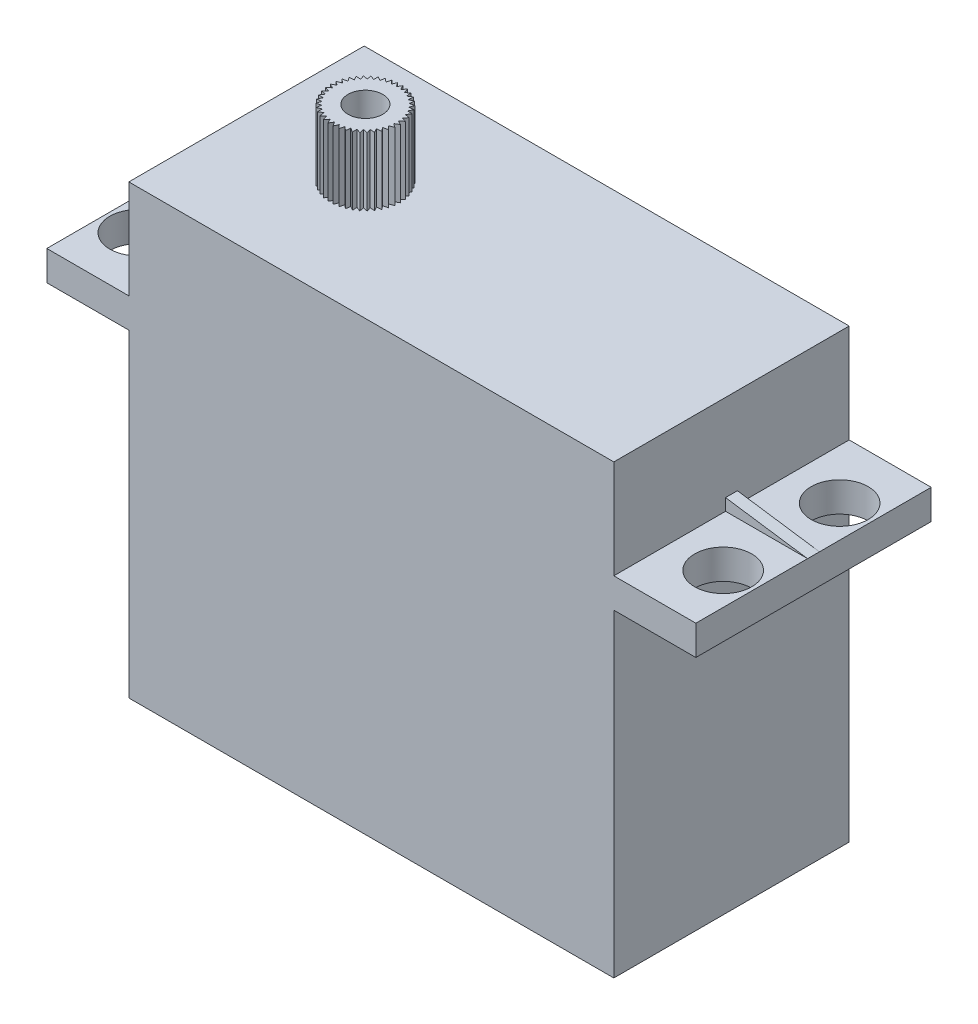
from build123d import *

# Parameters (mm, degrees)
SKETCH1_W               = 54.6
SKETCH1_H               = 19.8
FULL_BLOCK_DEPTH        = 37.6
TAB_CUT_REACH           = 52.508
SKETCH2_W               = 6.9
SKETCH2_H               = 26.8
SKETCH2_H_2             = 8.3
TAB_HOLES_1SIDE_REACH   = 43.253
SKETCH5_R               = 2.4
SKETCH6_W               = 6.9
SKETCH6_H               = 1
TAB_FIN_CHUNK_DEPTH     = 1
TAB_FIN_ANGLE_CUT_REACH = 49.615
SKETCH8_R               = 1.46
ROTOR_DEPTH             = 5.7


with BuildPart() as part:
    # Sketch1 → Full Block (new body)
    with BuildSketch(Plane(origin=(0, 0, 0), x_dir=(1, 0, 0), z_dir=(0, 1, 0))):
        Rectangle(SKETCH1_W, SKETCH1_H)
    extrude(amount=FULL_BLOCK_DEPTH)

    # Sketch2 → Tab cut (cut, up to next)
    with BuildSketch(Plane.XY.offset(9.9), mode=Mode.PRIVATE) as tab_cut_sk1:
        with Locations((-23.85, 13.4)):
            Rectangle(SKETCH2_W, SKETCH2_H)
    tab_cut_tool1 = extrude(tab_cut_sk1.sketch, amount=-TAB_CUT_REACH, mode=Mode.PRIVATE) & part.part
    # Sketch2 → Tab cut (cut, up to next)
    with BuildSketch(Plane.XY.offset(9.9), mode=Mode.PRIVATE) as tab_cut_sk2:
        with Locations((23.85, 13.4)):
            Rectangle(SKETCH2_W, SKETCH2_H)
    tab_cut_tool2 = extrude(tab_cut_sk2.sketch, amount=-TAB_CUT_REACH, mode=Mode.PRIVATE) & part.part
    # Sketch2 → Tab cut (cut, up to next)
    with BuildSketch(Plane.XY.offset(9.9), mode=Mode.PRIVATE) as tab_cut_sk3:
        with Locations((-23.85, 33.45)):
            Rectangle(SKETCH2_W, SKETCH2_H_2)
    tab_cut_tool3 = extrude(tab_cut_sk3.sketch, amount=-TAB_CUT_REACH, mode=Mode.PRIVATE) & part.part
    # Sketch2 → Tab cut (cut, up to next)
    with BuildSketch(Plane.XY.offset(9.9), mode=Mode.PRIVATE) as tab_cut_sk4:
        with Locations((23.85, 33.45)):
            Rectangle(SKETCH2_W, SKETCH2_H_2)
    tab_cut_tool4 = extrude(tab_cut_sk4.sketch, amount=-TAB_CUT_REACH, mode=Mode.PRIVATE) & part.part
    add(tab_cut_tool1.solids().sort_by_distance((-23.85, 13.4, 9.9))[0], mode=Mode.SUBTRACT)
    add(tab_cut_tool2.solids().sort_by_distance((23.85, 13.4, 9.9))[0], mode=Mode.SUBTRACT)
    add(tab_cut_tool3.solids().sort_by_distance((-23.85, 33.45, 9.9))[0], mode=Mode.SUBTRACT)
    add(tab_cut_tool4.solids().sort_by_distance((23.85, 33.45, 9.9))[0], mode=Mode.SUBTRACT)

    # Sketch5 → Tab holes (1side) (cut, up to next)
    with BuildSketch(Plane(origin=(0, 29.3, 0), x_dir=(1, 0, 0), z_dir=(0, 1, 0)), mode=Mode.PRIVATE) as tab_holes_1side_sk1:
        with Locations(Location((-24.6, 4.9, 0), (0, 0, 180))):
            Circle(SKETCH5_R)
    tab_holes_1side_tool1 = extrude(tab_holes_1side_sk1.sketch, amount=-TAB_HOLES_1SIDE_REACH, mode=Mode.PRIVATE) & part.part
    # Sketch5 → Tab holes (1side) (cut, up to next)
    with BuildSketch(Plane(origin=(0, 29.3, 0), x_dir=(1, 0, 0), z_dir=(0, 1, 0)), mode=Mode.PRIVATE) as tab_holes_1side_sk2:
        with Locations(Location((-24.6, -4.9, 0), (0, 0, 270))):
            Circle(SKETCH5_R)
    tab_holes_1side_tool2 = extrude(tab_holes_1side_sk2.sketch, amount=-TAB_HOLES_1SIDE_REACH, mode=Mode.PRIVATE) & part.part
    tab_holes_1side_1 = tab_holes_1side_tool1.solids().sort_by_distance((-24.6, 29.3, -4.9))[0]
    add(tab_holes_1side_1, mode=Mode.SUBTRACT)
    tab_holes_1side_2 = tab_holes_1side_tool2.solids().sort_by_distance((-24.6, 29.3, 4.9))[0]
    add(tab_holes_1side_2, mode=Mode.SUBTRACT)
    tab_holes_1side = tab_holes_1side_1 + tab_holes_1side_2  # Tab holes (1side) as one shape, for the pattern or mirror that repeats it

    # Tab holes mirror: Tab holes (1side) across plane
    add(tab_holes_1side.mirror(Plane(origin=(0, 0, 0), x_dir=(0, 0, 1), z_dir=(1, 0, 0))), mode=Mode.SUBTRACT)

    # Sketch6 → Tab Fin Chunk (add)
    with BuildSketch(Plane(origin=(0, 29.3, 0), x_dir=(1, 0, 0), z_dir=(0, 1, 0))):
        with Locations((-23.85, 0)):
            Rectangle(SKETCH6_W, SKETCH6_H)
    tab_fin_chunk = extrude(amount=TAB_FIN_CHUNK_DEPTH)

    # Sketch7 → Tab Fin Angle Cut (cut, up to next)
    with BuildSketch(Plane.XY.offset(0.5), mode=Mode.PRIVATE) as tab_fin_angle_cut_sk1:
        Polygon((-27.3, 29.3), (-20.4, 30.3), (-27.3, 30.3), align=None)
    tab_fin_angle_cut_tool1 = extrude(tab_fin_angle_cut_sk1.sketch, amount=-TAB_FIN_ANGLE_CUT_REACH, mode=Mode.PRIVATE) & part.part
    tab_fin_angle_cut = tab_fin_angle_cut_tool1.solids().sort_by_distance((-25, 29.966667, 0.5))[0]
    add(tab_fin_angle_cut, mode=Mode.SUBTRACT)

    # Tab Fin Mirror: Tab Fin Chunk, Tab Fin Angle Cut across plane
    add(tab_fin_chunk.mirror(Plane(origin=(0, 0, 0), x_dir=(0, 0, 1), z_dir=(1, 0, 0))))
    add(tab_fin_angle_cut.mirror(Plane(origin=(0, 0, 0), x_dir=(0, 0, 1), z_dir=(1, 0, 0))), mode=Mode.SUBTRACT)

    # Sketch8 → Rotor (add)
    with BuildSketch(Plane(origin=(0, 37.6, 0), x_dir=(1, 0, 0), z_dir=(0, 1, 0))):
        with BuildLine():
            ThreePointArc((-12.991754365, 0.206904111), (-12.991814191, 0.206153337), (-12.9918738, 0.205402545))
            Line((-12.9918738, 0.205402545), (-13.35, 0))
            Line((-13.35, 0), (-12.993644068, -0.181687781))
            ThreePointArc((-12.993644068, -0.181687781), (-12.993591329, -0.182439086), (-12.993538372, -0.183190376))
            Line((-12.993538372, -0.183190376), (-13.317050937, -0.439674685))
            Line((-13.317050937, -0.439674685), (-12.937596048, -0.566221068))
            ThreePointArc((-12.937596048, -0.566221068), (-12.937431922, -0.566956121), (-12.937267582, -0.567691128))
            Line((-12.937267582, -0.567691128), (-13.218939777, -0.869527765))
            Line((-13.218939777, -0.869527765), (-12.824862326, -0.938105912))
            ThreePointArc((-12.824862326, -0.938105912), (-12.824590478, -0.938808294), (-12.824318428, -0.939510597))
            Line((-12.824318428, -0.939510597), (-13.05785816, -1.27995703))
            Line((-13.05785816, -1.27995703), (-12.657961186, -1.28903502))
            ThreePointArc((-12.657961186, -1.28903502), (-12.65758769, -1.28968904), (-12.657214005, -1.290342952))
            Line((-12.657214005, -1.290342952), (-12.837404384, -1.661794171))
            Line((-12.837404384, -1.661794171), (-12.440620925, -1.611169216))
            ThreePointArc((-12.440620925, -1.611169216), (-12.440154124, -1.611760265), (-12.439687152, -1.612351178))
            Line((-12.439687152, -1.612351178), (-12.562503022, -2.006509576))
            Line((-12.562503022, -2.006509576), (-12.177696564, -1.897312554))
            ThreePointArc((-12.177696564, -1.897312554), (-12.177146886, -1.897827428), (-12.176597058, -1.898342143))
            Line((-12.176597058, -1.898342143), (-12.239294915, -2.306402873))
            Line((-12.239294915, -2.306402873), (-11.875061399, -2.141073065))
            ThreePointArc((-11.875061399, -2.141073065), (-11.874441122, -2.141500263), (-11.873820722, -2.141927282))
            Line((-11.873820722, -2.141927282), (-11.875, -2.554774941))
            Line((-11.875, -2.554774941), (-11.5394758, -2.337005541))
            ThreePointArc((-11.5394758, -2.337005541), (-11.538798781, -2.337335521), (-11.538121666, -2.337665304))
            Line((-11.538121666, -2.337665304), (-11.477756022, -2.746077559))
            Line((-11.477756022, -2.746077559), (-11.178436195, -2.480733176))
            ThreePointArc((-11.178436195, -2.480733176), (-11.177717557, -2.480958565), (-11.176998853, -2.481183746))
            Line((-11.176998853, -2.481183746), (-11.056436755, -2.876037341))
            Line((-11.056436755, -2.876037341), (-10.800007612, -2.569045331))
            ThreePointArc((-10.800007612, -2.569045331), (-10.799263407, -2.569161095), (-10.79851917, -2.569276644))
            Line((-10.79851917, -2.569276644), (-10.620453776, -2.941751202))
            Line((-10.620453776, -2.941751202), (-10.412643519, -2.599969258))
            ThreePointArc((-10.412643519, -2.599969258), (-10.411890373, -2.599972811), (-10.411137226, -2.599976146))
            Line((-10.411137226, -2.599976146), (-10.179546224, -2.941751202))
            Line((-10.179546224, -2.941751202), (-10.024996991, -2.572814168))
            ThreePointArc((-10.024996991, -2.572814168), (-10.024251728, -2.572705431), (-10.023506496, -2.572596479))
            Line((-10.023506496, -2.572596479), (-9.743563245, -2.876037341))
            Line((-9.743563245, -2.876037341), (-9.645727411, -2.488186661))
            ThreePointArc((-9.645727411, -2.488186661), (-9.645006678, -2.487968063), (-9.644286008, -2.487749256))
            Line((-9.644286008, -2.487749256), (-9.322243978, -2.746077559))
            Line((-9.322243978, -2.746077559), (-9.283307034, -2.347977176))
            ThreePointArc((-9.283307034, -2.347977176), (-9.282626931, -2.3476536), (-9.281946922, -2.347329827))
            Line((-9.281946922, -2.347329827), (-8.925, -2.554774941))
            Line((-8.925, -2.554774941), (-8.945831733, -2.155317761))
            ThreePointArc((-8.945831733, -2.155317761), (-8.945207452, -2.154896435), (-8.944583294, -2.154474927))
            Line((-8.944583294, -2.154474927), (-8.560705085, -2.306402873))
            Line((-8.560705085, -2.306402873), (-8.640840147, -1.914512108))
            ThreePointArc((-8.640840147, -1.914512108), (-8.640285635, -1.914002444), (-8.639731271, -1.913492619))
            Line((-8.639731271, -1.913492619), (-8.237496978, -2.006509576))
            Line((-8.237496978, -2.006509576), (-8.375145286, -1.630939419))
            ThreePointArc((-8.375145286, -1.630939419), (-8.374672929, -1.630352801), (-8.374200742, -1.629766047))
            Line((-8.374200742, -1.629766047), (-7.962595616, -1.661794171))
            Line((-7.962595616, -1.661794171), (-8.154682333, -1.310934238))
            ThreePointArc((-8.154682333, -1.310934238), (-8.154302683, -1.310283771), (-8.153923221, -1.309633194))
            Line((-8.153923221, -1.309633194), (-7.74214184, -1.27995703))
            Line((-7.74214184, -1.27995703), (-7.984376067, -0.961644952))
            ThreePointArc((-7.984376067, -0.961644952), (-7.984097604, -0.960945167), (-7.983819344, -0.9602453))
            Line((-7.983819344, -0.9602453), (-7.581060223, -0.869527765))
            Line((-7.581060223, -0.869527765), (-7.868030847, -0.590874107))
            ThreePointArc((-7.868030847, -0.590874107), (-7.867859792, -0.590140635), (-7.86768895, -0.589407113))
            Line((-7.86768895, -0.589407113), (-7.482949063, -0.439674685))
            Line((-7.482949063, -0.439674685), (-7.808245635, -0.206904111))
            ThreePointArc((-7.808245635, -0.206904111), (-7.808185809, -0.206153337), (-7.8081262, -0.205402545))
            Line((-7.8081262, -0.205402545), (-7.45, 0))
            Line((-7.45, 0), (-7.806355932, 0.181687781))
            ThreePointArc((-7.806355932, 0.181687781), (-7.806408671, 0.182439086), (-7.806461628, 0.183190376))
            Line((-7.806461628, 0.183190376), (-7.482949063, 0.439674685))
            Line((-7.482949063, 0.439674685), (-7.862403952, 0.566221068))
            ThreePointArc((-7.862403952, 0.566221068), (-7.862568078, 0.566956121), (-7.862732418, 0.567691128))
            Line((-7.862732418, 0.567691128), (-7.581060223, 0.869527765))
            Line((-7.581060223, 0.869527765), (-7.975137674, 0.938105912))
            ThreePointArc((-7.975137674, 0.938105912), (-7.975409522, 0.938808294), (-7.975681572, 0.939510597))
            Line((-7.975681572, 0.939510597), (-7.74214184, 1.27995703))
            Line((-7.74214184, 1.27995703), (-8.142038814, 1.28903502))
            ThreePointArc((-8.142038814, 1.28903502), (-8.14241231, 1.28968904), (-8.142785995, 1.290342952))
            Line((-8.142785995, 1.290342952), (-7.962595616, 1.661794171))
            Line((-7.962595616, 1.661794171), (-8.359379075, 1.611169216))
            ThreePointArc((-8.359379075, 1.611169216), (-8.359845876, 1.611760265), (-8.360312848, 1.612351178))
            Line((-8.360312848, 1.612351178), (-8.237496978, 2.006509576))
            Line((-8.237496978, 2.006509576), (-8.622303436, 1.897312554))
            ThreePointArc((-8.622303436, 1.897312554), (-8.622853114, 1.897827428), (-8.623402942, 1.898342143))
            Line((-8.623402942, 1.898342143), (-8.560705085, 2.306402873))
            Line((-8.560705085, 2.306402873), (-8.924938601, 2.141073065))
            ThreePointArc((-8.924938601, 2.141073065), (-8.925558878, 2.141500263), (-8.926179278, 2.141927282))
            Line((-8.926179278, 2.141927282), (-8.925, 2.554774941))
            Line((-8.925, 2.554774941), (-9.2605242, 2.337005541))
            ThreePointArc((-9.2605242, 2.337005541), (-9.261201219, 2.337335521), (-9.261878334, 2.337665304))
            Line((-9.261878334, 2.337665304), (-9.322243978, 2.746077559))
            Line((-9.322243978, 2.746077559), (-9.621563805, 2.480733176))
            ThreePointArc((-9.621563805, 2.480733176), (-9.622282443, 2.480958565), (-9.623001147, 2.481183746))
            Line((-9.623001147, 2.481183746), (-9.743563245, 2.876037341))
            Line((-9.743563245, 2.876037341), (-9.999992388, 2.569045331))
            ThreePointArc((-9.999992388, 2.569045331), (-10.000736593, 2.569161095), (-10.00148083, 2.569276644))
            Line((-10.00148083, 2.569276644), (-10.179546224, 2.941751202))
            Line((-10.179546224, 2.941751202), (-10.387356481, 2.599969258))
            ThreePointArc((-10.387356481, 2.599969258), (-10.388109627, 2.599972811), (-10.388862774, 2.599976146))
            Line((-10.388862774, 2.599976146), (-10.620453776, 2.941751202))
            Line((-10.620453776, 2.941751202), (-10.775003009, 2.572814168))
            ThreePointArc((-10.775003009, 2.572814168), (-10.775748272, 2.572705431), (-10.776493504, 2.572596479))
            Line((-10.776493504, 2.572596479), (-11.056436755, 2.876037341))
            Line((-11.056436755, 2.876037341), (-11.154272589, 2.488186661))
            ThreePointArc((-11.154272589, 2.488186661), (-11.154993322, 2.487968063), (-11.155713992, 2.487749256))
            Line((-11.155713992, 2.487749256), (-11.477756022, 2.746077559))
            Line((-11.477756022, 2.746077559), (-11.516692966, 2.347977176))
            ThreePointArc((-11.516692966, 2.347977176), (-11.517373069, 2.3476536), (-11.518053078, 2.347329827))
            Line((-11.518053078, 2.347329827), (-11.875, 2.554774941))
            Line((-11.875, 2.554774941), (-11.854168267, 2.155317761))
            ThreePointArc((-11.854168267, 2.155317761), (-11.854792548, 2.154896435), (-11.855416706, 2.154474927))
            Line((-11.855416706, 2.154474927), (-12.239294915, 2.306402873))
            Line((-12.239294915, 2.306402873), (-12.159159853, 1.914512108))
            ThreePointArc((-12.159159853, 1.914512108), (-12.159714365, 1.914002444), (-12.160268729, 1.913492619))
            Line((-12.160268729, 1.913492619), (-12.562503022, 2.006509576))
            Line((-12.562503022, 2.006509576), (-12.424854714, 1.630939419))
            ThreePointArc((-12.424854714, 1.630939419), (-12.425327071, 1.630352801), (-12.425799258, 1.629766047))
            Line((-12.425799258, 1.629766047), (-12.837404384, 1.661794171))
            Line((-12.837404384, 1.661794171), (-12.645317667, 1.310934238))
            ThreePointArc((-12.645317667, 1.310934238), (-12.645697317, 1.310283771), (-12.646076779, 1.309633194))
            Line((-12.646076779, 1.309633194), (-13.05785816, 1.27995703))
            Line((-13.05785816, 1.27995703), (-12.815623933, 0.961644952))
            ThreePointArc((-12.815623933, 0.961644952), (-12.815902396, 0.960945167), (-12.816180656, 0.9602453))
            Line((-12.816180656, 0.9602453), (-13.218939777, 0.869527765))
            Line((-13.218939777, 0.869527765), (-12.931969153, 0.590874107))
            ThreePointArc((-12.931969153, 0.590874107), (-12.932140208, 0.590140635), (-12.93231105, 0.589407113))
            Line((-12.93231105, 0.589407113), (-13.317050937, 0.439674685))
            Line((-13.317050937, 0.439674685), (-12.991754365, 0.206904111))
        make_face()
        with Locations(Location((-10.4, 0, 0), (0, 0, 270))):
            Circle(SKETCH8_R, mode=Mode.SUBTRACT)
    extrude(amount=ROTOR_DEPTH)


solid = part.part
